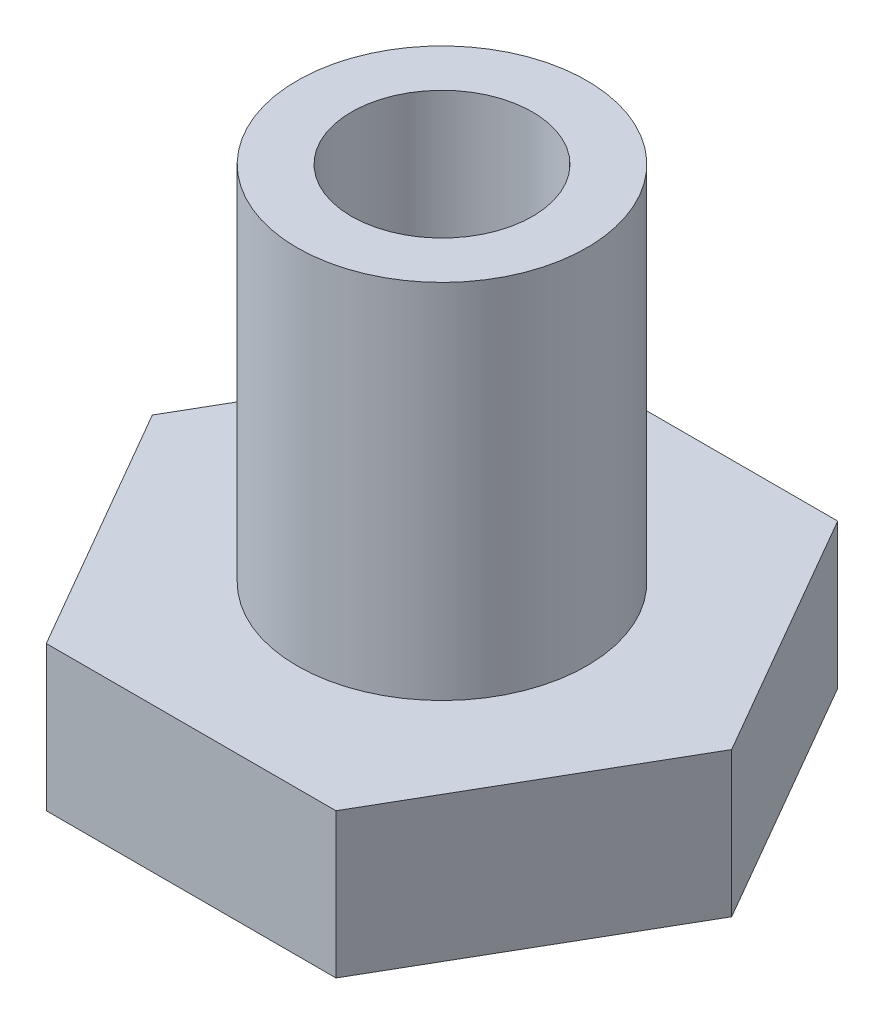
from build123d import *

# Parameters (mm, degrees)
EXTRUDE_2_DEPTH     = 8
SKETCH_3_R          = 8
EXTRUDE_3_DEPTH     = 20
SKETCH_4_R          = 5
CUT_EXTRUDE_1_DEPTH = 20


with BuildPart() as part:
    # 草图1 → 凸台-拉伸2 (new body)
    with BuildSketch(Plane(origin=(0, 0, 0), x_dir=(1, 0, 0), z_dir=(0, 1, 0))):
        Polygon((8, -13.856406461), (16, 0), (8, 13.856406461), (-8, 13.856406461), (-16, 0), (-8, -13.856406461), align=None)
    extrude(amount=EXTRUDE_2_DEPTH)

    # 草图3 → 凸台-拉伸3 (add)
    with BuildSketch(Plane(origin=(0, 8, 0), x_dir=(1, 0, 0), z_dir=(0, 1, 0))):
        with Locations(Location((0, 0, 0), (0, 0, 270))):
            Circle(SKETCH_3_R)
    extrude(amount=EXTRUDE_3_DEPTH)

    # 草图4 → 切除-拉伸1 (cut)
    with BuildSketch(Plane(origin=(0, 28, 0), x_dir=(1, 0, 0), z_dir=(0, 1, 0))):
        with Locations(Location((0, 0, 0), (0, 0, 270))):
            Circle(SKETCH_4_R)
    extrude(amount=-CUT_EXTRUDE_1_DEPTH, mode=Mode.SUBTRACT)


solid = part.part
